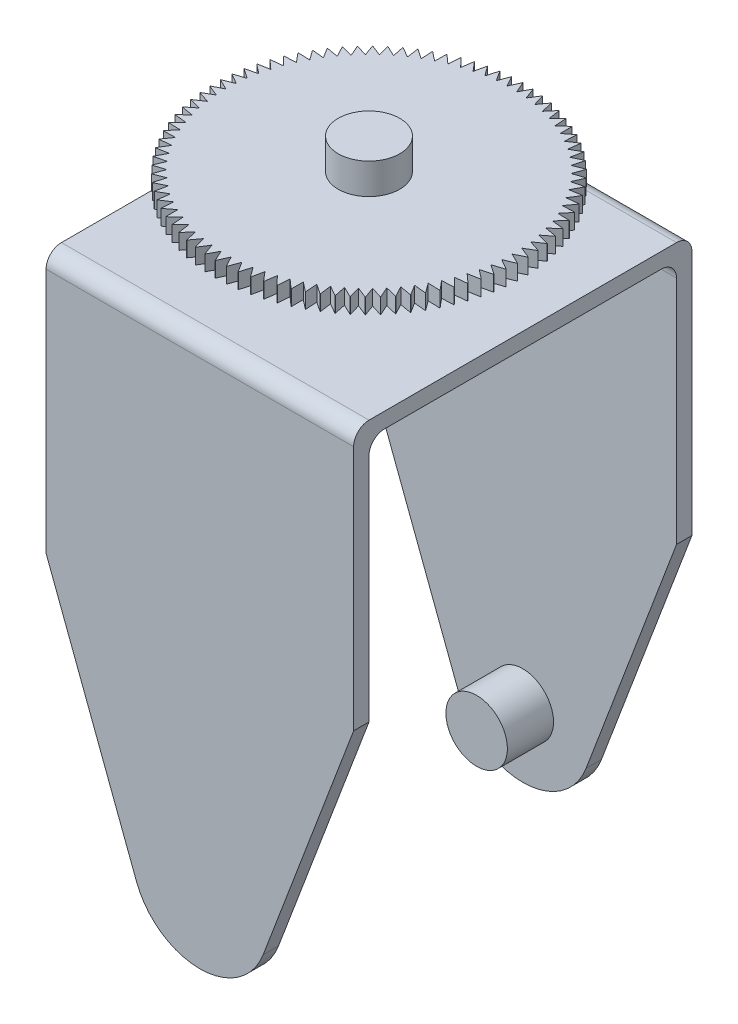
from build123d import *

# Parameters (mm, degrees)
BOSS_EXTRUDE1_DEPTH = 5
SKETCH4_R           = 10
BOSS_EXTRUDE2_DEPTH = 15
SKETCH5_W           = 100
SKETCH5_H           = 5
BOSS_EXTRUDE3_DEPTH = 55
FILLET1_R           = 5
SKETCH6_R           = 12.5
BOSS_EXTRUDE4_DEPTH = 5
SKETCH7_R           = 10
BOSS_EXTRUDE5_DEPTH = 5
SKETCH8_R           = 12.5
BOSS_EXTRUDE6_DEPTH = 5
BOSS_EXTRUDE7_DEPTH = 5
SKETCH10_R          = 10
BOSS_EXTRUDE8_DEPTH = 10


with BuildPart() as part:
    # Sketch3 → Boss-Extrude1 (new body)
    with BuildSketch(Plane.XY):
        with BuildLine():
            Line((-50, 150), (50, 150))
            Line((50, 150), (50, 70))
            Line((50, 70), (20.577059051, -7.783613608))
            ThreePointArc((20.577059051, -7.783613608), (0, -22), (-20.577059051, -7.783613608))
            Line((-20.577059051, -7.783613608), (-50, 70))
            Line((-50, 70), (-50, 150))
        make_face()
    extrude(amount=BOSS_EXTRUDE1_DEPTH)

    # Sketch4 → Boss-Extrude2 (add)
    with BuildSketch(Plane.XY.offset(5)):
        Circle(SKETCH4_R)
    extrude(amount=BOSS_EXTRUDE2_DEPTH)

    # Sketch5 → Boss-Extrude3 (add)
    with BuildSketch(Plane(origin=(0, 0, 0), x_dir=(-1, 0, 0), z_dir=(0, 0, -1))):
        with Locations((0, 152.5)):
            Rectangle(SKETCH5_W, SKETCH5_H)
    extrude(amount=-BOSS_EXTRUDE3_DEPTH)

    # Mirror1: part across plane


with BuildPart() as part_1:
    add(part.part)
    add(part.part.mirror(Plane.XY.offset(55)))

    # Fillet1
    fillet1_edges = [part_1.edges().sort_by_distance(p)[0] for p in [
        (0, 150, 105),
        (0, 150, 5),
        (0, 155, 110),
        (0, 155, 0),
    ]]
    fillet(fillet1_edges, radius=FILLET1_R)

    # Sketch6 → Boss-Extrude4 (add)
    with BuildSketch(Plane(origin=(0, 155, 0), x_dir=(1, 0, 0), z_dir=(0, 1, 0))):
        with Locations((0, -55)):
            Circle(SKETCH6_R)
    extrude(amount=BOSS_EXTRUDE4_DEPTH)

    # Sketch7 → Boss-Extrude5 (add)
    with BuildSketch(Plane(origin=(0, 160, 0), x_dir=(1, 0, 0), z_dir=(0, 1, 0))):
        with Locations((0, -55)):
            Circle(SKETCH7_R)
    extrude(amount=BOSS_EXTRUDE5_DEPTH)

    # Sketch8 → Boss-Extrude6 (add)
    with BuildSketch(Plane(origin=(0, 165, 0), x_dir=(1, 0, 0), z_dir=(0, 1, 0))):
        with Locations((0, -55)):
            Circle(SKETCH8_R)
    extrude(amount=BOSS_EXTRUDE6_DEPTH)

    # Sketch9 → Boss-Extrude7 (add)
    with BuildSketch(Plane(origin=(0, 170, 0), x_dir=(1, 0, 0), z_dir=(0, 1, 0))):
        with BuildLine():
            Line((1.592913605, -8.533590821), (0, -5))
            ThreePointArc((0, -5), (-0.03195169, -5.000010209), (-0.063903368, -5.000040836))
            Line((-0.063903368, -5.000040836), (-1.652299505, -8.535664623))
            Line((-1.652299505, -8.535664623), (-3.487823687, -5.121797487))
            ThreePointArc((-3.487823687, -5.121797487), (-3.519696833, -5.124036509), (-3.551568541, -5.126295898))
            Line((-3.551568541, -5.126295898), (-4.889462777, -8.764107995))
            Line((-4.889462777, -8.764107995), (-6.958655048, -5.486596563))
            ThreePointArc((-6.958655048, -5.486596563), (-6.990294366, -5.491053489), (-7.021930829, -5.495530632))
            Line((-7.021930829, -5.495530632), (-8.102805078, -9.217807986))
            Line((-8.102805078, -9.217807986), (-10.395584541, -6.092619963))
            ThreePointArc((-10.395584541, -6.092619963), (-10.426835888, -6.099273079), (-10.458082976, -6.105946165))
            Line((-10.458082976, -6.105946165), (-11.276671327, -9.894554215))
            Line((-11.276671327, -9.894554215), (-13.781867791, -6.936915203))
            ThreePointArc((-13.781867791, -6.936915203), (-13.812578913, -6.945732096), (-13.843284395, -6.954568613))
            Line((-13.843284395, -6.954568613), (-14.395598767, -10.791049641))
            Line((-14.395598767, -10.791049641), (-17.101007166, -8.015368961))
            ThreePointArc((-17.101007166, -8.015368961), (-17.131028442, -8.026306676), (-17.161042723, -8.037263573))
            Line((-17.161042723, -8.037263573), (-17.444392297, -11.90292663))
            Line((-17.444392297, -11.90292663), (-20.336832154, -9.322727118))
            ThreePointArc((-20.336832154, -9.322727118), (-20.366017323, -9.335732368), (-20.395194176, -9.348756265))
            Line((-20.395194176, -9.348756265), (-20.408198501, -13.224768228))
            Line((-20.408198501, -13.224768228), (-23.473578139, -10.852620357))
            ThreePointArc((-23.473578139, -10.852620357), (-23.501785015, -10.867629781), (-23.529982293, -10.882657227))
            Line((-23.529982293, -10.882657227), (-23.272578014, -14.750134555))
            Line((-23.272578014, -14.750134555), (-26.495963212, -12.597595192))
            ThreePointArc((-26.495963212, -12.597595192), (-26.523054372, -12.614535666), (-26.550134701, -12.631493449))
            Line((-26.550134701, -12.631493449), (-26.023575865, -16.471594182))
            Line((-26.023575865, -16.471594182), (-29.389262615, -14.549150281))
            ThreePointArc((-29.389262615, -14.549150281), (-29.415106074, -14.567939273), (-29.440937522, -14.586744776))
            Line((-29.440937522, -14.586744776), (-28.647789471, -18.380760329))
            Line((-28.647789471, -18.380760329), (-32.139380484, -16.697777844))
            ThreePointArc((-32.139380484, -16.697777844), (-32.163850337, -16.718323815), (-32.188307055, -16.73888542))
            Line((-32.188307055, -16.73888542), (-31.132433927, -20.46833173))
            Line((-31.132433927, -20.46833173), (-34.732918523, -19.033009983))
            ThreePointArc((-34.732918523, -19.033009983), (-34.755895554, -19.055212836), (-34.778858391, -19.077430368))
            Line((-34.778858391, -19.077430368), (-33.465404293, -22.724137948))
            Line((-33.465404293, -22.724137948), (-37.157241274, -21.543469682))
            ThreePointArc((-37.157241274, -21.543469682), (-37.178613541, -21.567221247), (-37.199970626, -21.590986464))
            Line((-37.199970626, -21.590986464), (-35.635334574, -25.137188922))
            Line((-35.635334574, -25.137188922), (-39.40053768, -24.216926234))
            ThreePointArc((-39.40053768, -24.216926234), (-39.42020106, -24.242110795), (-39.439848343, -24.267307916))
            Line((-39.439848343, -24.267307916), (-37.631653087, -27.695728509))
            Line((-37.631653087, -27.695728509), (-41.451878628, -27.040354827))
            ThreePointArc((-41.451878628, -27.040354826), (-41.469737323, -27.066849687), (-41.487579083, -27.093355955))
            Line((-41.487579083, -27.093355955), (-39.444633969, -30.387291763))
            Line((-39.444633969, -30.387291763), (-43.301270189, -30))
            ThreePointArc((-43.301270189, -30), (-43.317237193, -30.02767608), (-43.333186508, -30.055362358))
            Line((-43.333186508, -30.055362358), (-41.065444559, -33.198765657))
            Line((-41.065444559, -33.198765657), (-44.939702315, -33.081442661))
            ThreePointArc((-44.939702315, -33.081442661), (-44.953699838, -33.110165125), (-44.967679004, -33.138896529))
            Line((-44.967679004, -33.138896529), (-42.486188431, -36.116452973))
            Line((-42.486188431, -36.116452973), (-46.359192728, -36.269670329))
            ThreePointArc((-46.359192728, -36.269670329), (-46.371152577, -36.299299245), (-46.383093488, -36.328935798))
            Line((-46.383093488, -36.328935798), (-43.699943864, -39.126139033))
            Line((-43.699943864, -39.126139033), (-47.552825815, -39.549150281))
            ThreePointArc((-47.552825815, -39.549150281), (-47.562689721, -39.579541299), (-47.572534204, -39.609938615))
            Line((-47.572534204, -39.609938615), (-44.700797563, -42.213160947))
            Line((-44.700797563, -42.213160947), (-48.514786314, -42.90390522))
            ThreePointArc((-48.514786314, -42.90390522), (-48.522506221, -42.934910279), (-48.530206314, -42.965920264))
            Line((-48.530206314, -42.965920264), (-45.483873469, -45.362479056))
            Line((-45.483873469, -45.362479056), (-49.240387651, -46.317591117))
            ThreePointArc((-49.240387651, -46.317591117), (-49.245925949, -46.349059162), (-49.251444138, -46.38053074))
            Line((-49.251444138, -46.38053074), (-46.045356516, -48.558750198))
            Line((-46.045356516, -48.558750198), (-49.726094768, -49.773576837))
            ThreePointArc((-49.726094768, -49.773576837), (-49.729424476, -49.80535456), (-49.732733877, -49.837134404))
            Line((-49.732733876, -49.837134404), (-46.382511214, -51.786402461))
            Line((-46.382511214, -51.786402461), (-49.969541351, -53.255025165))
            ThreePointArc((-49.969541351, -53.255025165), (-49.970646246, -53.286957748), (-49.971730735, -53.31889103))
            Line((-49.971730735, -53.31889103), (-46.493694981, -55.029711049))
            Line((-46.493694981, -55.029711049), (-49.969541351, -56.744974835))
            ThreePointArc((-49.969541351, -56.744974835), (-49.96841605, -56.776906705), (-49.967270344, -56.80883785))
            Line((-49.967270344, -56.80883785), (-46.378366138, -58.272874888))
            Line((-46.378366138, -58.272874888), (-49.726094768, -60.226423163))
            ThreePointArc((-49.726094768, -60.226423163), (-49.722744754, -60.258198752), (-49.719374435, -60.289972193))
            Line((-49.719374435, -60.289972193), (-46.037086558, -61.500093609))
            Line((-46.037086558, -61.500093609), (-49.240387651, -63.682408883))
            ThreePointArc((-49.240387651, -63.682408883), (-49.234829244, -63.713873383), (-49.229250731, -63.745334324))
            Line((-49.229250731, -63.745334324), (-45.47151892, -64.695644527))
            Line((-45.47151892, -64.695644527), (-48.514786314, -67.09609478))
            ThreePointArc((-48.514786314, -67.09609478), (-48.507046594, -67.127094899), (-48.499287066, -67.158090066))
            Line((-48.499287066, -67.158090066), (-44.684418613, -67.84395924))
            Line((-44.684418613, -67.84395924), (-47.552825815, -70.450849719))
            ThreePointArc((-47.552825815, -70.450849719), (-47.54294249, -70.481234427), (-47.53303975, -70.511612814))
            Line((-47.53303975, -70.511612814), (-43.679620309, -70.929699475))
            Line((-43.679620309, -70.929699475), (-46.359192728, -73.730329671))
            ThreePointArc((-46.359192728, -73.730329671), (-46.347213949, -73.759950938), (-46.335216242, -73.789564544))
            Line((-46.335216242, -73.789564544), (-42.462019286, -73.937831815))
            Line((-42.462019286, -73.937831815), (-44.939702315, -76.91855734))
            ThreePointArc((-44.939702315, -76.91855734), (-44.92568644, -76.947270853), (-44.911652219, -76.975975405))
            Line((-44.911652219, -76.975975405), (-41.037547574, -76.853700942))
            Line((-41.037547574, -76.853700942), (-43.301270189, -80))
            ThreePointArc((-43.301270189, -80), (-43.285285503, -80.027665871), (-43.26928314, -80.055321522))
            Line((-43.26928314, -80.055321522), (-39.413145054, -79.663101034))
            Line((-39.413145054, -79.663101034), (-41.451878628, -82.959645174))
            ThreePointArc((-41.451878628, -82.959645174), (-41.434003005, -82.986128617), (-41.416110463, -83.012600631))
            Line((-41.416110463, -83.012600631), (-37.596725654, -82.352344978))
            Line((-37.596725654, -82.352344978), (-39.40053768, -85.783073766))
            ThreePointArc((-39.40053768, -85.783073766), (-39.380858211, -85.808245757), (-39.361162659, -85.833405166))
            Line((-39.361162659, -85.833405166), (-35.597138786, -84.908331046))
            Line((-35.597138786, -84.908331046), (-37.157241274, -88.456530318))
            ThreePointArc((-37.157241274, -88.456530318), (-37.135853833, -88.48026822), (-37.114451227, -88.50399245))
            Line((-37.114451227, -88.50399245), (-33.424126235, -87.318606732))
            Line((-33.424126235, -87.318606732), (-34.732918523, -90.966990017))
            ThreePointArc((-34.732918523, -90.966990017), (-34.709927308, -90.989178182), (-34.68692192, -91.011351651))
            Line((-34.68692192, -91.011351651), (-31.088274702, -89.571429415))
            Line((-31.088274702, -89.571429415), (-32.139380484, -93.302222156))
            ThreePointArc((-32.139380484, -93.302222156), (-32.114897507, -93.322752486), (-32.090401415, -93.343267167))
            Line((-32.090401415, -93.343267167), (-28.600964219, -91.655823568))
            Line((-28.600964219, -91.655823568), (-29.389262615, -95.450849719))
            ThreePointArc((-29.389262615, -95.450849719), (-29.363407153, -95.469622192), (-29.337539701, -95.488378139))
            Line((-29.337539701, -95.488378139), (-25.974312713, -93.561634234))
            Line((-25.974312713, -93.561634234), (-26.495963212, -97.402404808))
            ThreePointArc((-26.495963212, -97.402404808), (-26.468861231, -97.419327966), (-26.441748442, -97.436233802))
            Line((-26.441748442, -97.436233802), (-23.221116967, -95.279576494))
            Line((-23.221116967, -95.279576494), (-23.473578139, -99.147379643))
            ThreePointArc((-23.473578139, -99.147379643), (-23.445361678, -99.162371039), (-23.417135643, -99.177344401))
            Line((-23.417135643, -99.177344401), (-20.354790273, -96.801280706))
            Line((-20.354790273, -96.801280706), (-20.336832154, -100.677272882))
            ThreePointArc((-20.336832154, -100.677272882), (-20.30763868, -100.690259479), (-20.278436913, -100.703227418))
            Line((-20.278436913, -100.703227418), (-17.389297087, -98.11933328))
            Line((-17.389297087, -98.11933328), (-17.101007166, -101.984631039))
            ThreePointArc((-17.101007166, -101.984631039), (-17.070978907, -101.995549568), (-17.040943676, -102.006448905))
            Line((-17.040943676, -102.006448905), (-14.339084993, -99.227312797))
            Line((-14.339084993, -99.227312797), (-13.781867791, -103.063084797))
            ThreePointArc((-13.781867791, -103.063084797), (-13.751151041, -103.071882063), (-13.720428675, -103.080659698))
            Line((-13.720428675, -103.080659698), (-11.219014319, -100.119821292))
            Line((-11.219014319, -100.119821292), (-10.395584541, -103.907380037))
            ThreePointArc((-10.395584541, -103.907380037), (-10.364328949, -103.914013181), (-10.333069124, -103.92062635))
            Line((-10.333069124, -103.92062635), (-8.044285735, -100.792510553))
            Line((-8.044285735, -100.792510553), (-6.958655048, -104.513403437))
            ThreePointArc((-6.958655048, -104.513403437), (-6.927012888, -104.517840143), (-6.8953679, -104.522256628))
            Line((-6.8953679, -104.522256628), (-4.830366199, -101.242103305))
            Line((-4.830366199, -101.242103305), (-3.487823687, -104.878202513))
            ThreePointArc((-3.487823687, -104.878202513), (-3.455949117, -104.880421166), (-3.424073136, -104.88261945))
            Line((-3.424073136, -104.88261945), (-1.592913605, -101.466409179))
            Line((-1.592913605, -101.466409179), (0, -105))
            ThreePointArc((0, -105), (0.031951691, -104.999989791), (0.063903368, -104.999959164))
            Line((0.063903368, -104.999959164), (1.652299505, -101.464335377))
            Line((1.652299505, -101.464335377), (3.487823687, -104.878202513))
            ThreePointArc((3.487823687, -104.878202513), (3.519696833, -104.875963491), (3.551568541, -104.873704102))
            Line((3.551568541, -104.873704102), (4.889462777, -101.235892005))
            Line((4.889462777, -101.235892005), (6.958655048, -104.513403437))
            ThreePointArc((6.958655048, -104.513403437), (6.990294366, -104.508946511), (7.021930829, -104.504469368))
            Line((7.021930829, -104.504469368), (8.102805078, -100.782192014))
            Line((8.102805078, -100.782192014), (10.395584541, -103.907380037))
            ThreePointArc((10.395584541, -103.907380037), (10.426835888, -103.900726921), (10.458082977, -103.894053835))
            Line((10.458082977, -103.894053835), (11.276671327, -100.105445785))
            Line((11.276671327, -100.105445785), (13.781867791, -103.063084797))
            ThreePointArc((13.781867791, -103.063084797), (13.812578913, -103.054267904), (13.843284395, -103.045431387))
            Line((13.843284395, -103.045431387), (14.395598767, -99.208950359))
            Line((14.395598767, -99.208950359), (17.101007166, -101.984631039))
            ThreePointArc((17.101007166, -101.984631039), (17.131028442, -101.973693324), (17.161042723, -101.962736427))
            Line((17.161042723, -101.962736427), (17.444392297, -98.09707337))
            Line((17.444392297, -98.09707337), (20.336832154, -100.677272882))
            ThreePointArc((20.336832154, -100.677272882), (20.366017323, -100.664267632), (20.395194176, -100.651243735))
            Line((20.395194176, -100.651243735), (20.408198501, -96.775231772))
            Line((20.408198501, -96.775231772), (23.473578139, -99.147379643))
            ThreePointArc((23.473578139, -99.147379643), (23.501785015, -99.132370219), (23.529982293, -99.117342772))
            Line((23.529982293, -99.117342773), (23.272578014, -95.249865445))
            Line((23.272578014, -95.249865445), (26.495963212, -97.402404808))
            ThreePointArc((26.495963212, -97.402404808), (26.523054372, -97.385464334), (26.550134701, -97.368506551))
            Line((26.550134701, -97.368506551), (26.023575865, -93.528405818))
            Line((26.023575865, -93.528405818), (29.389262615, -95.450849719))
            ThreePointArc((29.389262615, -95.450849719), (29.415106075, -95.432060727), (29.440937522, -95.413255224))
            Line((29.440937522, -95.413255224), (28.647789471, -91.619239671))
            Line((28.647789471, -91.619239671), (32.139380484, -93.302222156))
            ThreePointArc((32.139380484, -93.302222156), (32.163850337, -93.281676185), (32.188307055, -93.26111458))
            Line((32.188307055, -93.26111458), (31.132433927, -89.53166827))
            Line((31.132433927, -89.53166827), (34.732918523, -90.966990017))
            ThreePointArc((34.732918523, -90.966990017), (34.755895554, -90.944787164), (34.778858392, -90.922569632))
            Line((34.778858392, -90.922569632), (33.465404293, -87.275862052))
            Line((33.465404293, -87.275862052), (37.157241274, -88.456530318))
            ThreePointArc((37.157241274, -88.456530318), (37.178613541, -88.432778753), (37.199970626, -88.409013536))
            Line((37.199970626, -88.409013536), (35.635334574, -84.862811078))
            Line((35.635334574, -84.862811078), (39.40053768, -85.783073766))
            ThreePointArc((39.40053768, -85.783073766), (39.42020106, -85.757889205), (39.439848343, -85.732692084))
            Line((39.439848343, -85.732692084), (37.631653087, -82.304271491))
            Line((37.631653087, -82.304271491), (41.451878628, -82.959645173))
            ThreePointArc((41.451878628, -82.959645173), (41.469737323, -82.933150313), (41.487579083, -82.906644045))
            Line((41.487579083, -82.906644045), (39.444633969, -79.612708237))
            Line((39.444633969, -79.612708237), (43.301270189, -80))
            ThreePointArc((43.301270189, -80), (43.317237193, -79.97232392), (43.333186508, -79.944637642))
            Line((43.333186508, -79.944637642), (41.065444559, -76.801234343))
            Line((41.065444559, -76.801234343), (44.939702315, -76.918557339))
            ThreePointArc((44.939702315, -76.918557339), (44.953699838, -76.889834875), (44.967679004, -76.861103471))
            Line((44.967679004, -76.861103471), (42.486188431, -73.883547027))
            Line((42.486188431, -73.883547027), (46.359192728, -73.730329671))
            ThreePointArc((46.359192728, -73.730329671), (46.371152577, -73.700700755), (46.383093488, -73.671064202))
            Line((46.383093488, -73.671064202), (43.699943864, -70.873860967))
            Line((43.699943864, -70.873860967), (47.552825815, -70.450849719))
            ThreePointArc((47.552825815, -70.450849719), (47.562689721, -70.4204587), (47.572534204, -70.390061385))
            Line((47.572534204, -70.390061385), (44.700797563, -67.786839053))
            Line((44.700797563, -67.786839053), (48.514786314, -67.09609478))
            ThreePointArc((48.514786314, -67.09609478), (48.522506221, -67.065089721), (48.530206314, -67.034079736))
            Line((48.530206314, -67.034079736), (45.483873469, -64.637520944))
            Line((45.483873469, -64.637520944), (49.240387651, -63.682408883))
            ThreePointArc((49.240387651, -63.682408883), (49.245925949, -63.650940838), (49.251444138, -63.61946926))
            Line((49.251444138, -63.61946926), (46.045356516, -61.441249802))
            Line((46.045356516, -61.441249802), (49.726094768, -60.226423163))
            ThreePointArc((49.726094768, -60.226423163), (49.729424476, -60.19464544), (49.732733877, -60.162865596))
            Line((49.732733877, -60.162865596), (46.382511215, -58.213597539))
            Line((46.382511215, -58.213597539), (49.969541351, -56.744974835))
            ThreePointArc((49.969541351, -56.744974835), (49.970646246, -56.713042252), (49.971730735, -56.68110897))
            Line((49.971730735, -56.68110897), (46.493694981, -54.970288951))
            Line((46.493694981, -54.970288951), (49.969541351, -53.255025165))
            ThreePointArc((49.969541351, -53.255025165), (49.96841605, -53.223093295), (49.967270344, -53.19116215))
            Line((49.967270344, -53.19116215), (46.378366139, -51.727125112))
            Line((46.378366139, -51.727125112), (49.726094768, -49.773576837))
            ThreePointArc((49.726094768, -49.773576837), (49.722744754, -49.741801248), (49.719374435, -49.710027807))
            Line((49.719374435, -49.710027807), (46.037086558, -48.499906391))
            Line((46.037086558, -48.499906391), (49.240387651, -46.317591117))
            ThreePointArc((49.240387651, -46.317591117), (49.234829244, -46.286126617), (49.229250731, -46.254665676))
            Line((49.229250731, -46.254665676), (45.47151892, -45.304355473))
            Line((45.47151892, -45.304355473), (48.514786314, -42.90390522))
            ThreePointArc((48.514786314, -42.90390522), (48.507046594, -42.872905101), (48.499287066, -42.841909934))
            Line((48.499287067, -42.841909934), (44.684418613, -42.15604076))
            Line((44.684418613, -42.15604076), (47.552825815, -39.549150281))
            ThreePointArc((47.552825815, -39.549150281), (47.54294249, -39.518765573), (47.53303975, -39.488387186))
            Line((47.53303975, -39.488387186), (43.679620309, -39.070300525))
            Line((43.679620309, -39.070300525), (46.359192728, -36.269670329))
            ThreePointArc((46.359192728, -36.269670329), (46.347213949, -36.240049062), (46.335216243, -36.210435456))
            Line((46.335216243, -36.210435456), (42.462019286, -36.062168185))
            Line((42.462019286, -36.062168185), (44.939702315, -33.08144266))
            ThreePointArc((44.939702315, -33.081442661), (44.92568644, -33.052729147), (44.911652219, -33.024024595))
            Line((44.911652219, -33.024024595), (41.037547574, -33.146299058))
            Line((41.037547574, -33.146299058), (43.301270189, -30))
            ThreePointArc((43.301270189, -30), (43.285285503, -29.972334129), (43.26928314, -29.944678478))
            Line((43.26928314, -29.944678478), (39.413145054, -30.336898966))
            Line((39.413145054, -30.336898966), (41.451878628, -27.040354826))
            ThreePointArc((41.451878628, -27.040354826), (41.434003005, -27.013871383), (41.416110463, -26.987399369))
            Line((41.416110463, -26.987399369), (37.596725654, -27.647655022))
            Line((37.596725654, -27.647655022), (39.40053768, -24.216926234))
            ThreePointArc((39.40053768, -24.216926234), (39.380858211, -24.191754243), (39.361162659, -24.166594834))
            Line((39.361162659, -24.166594834), (35.597138786, -25.091668954))
            Line((35.597138786, -25.091668954), (37.157241274, -21.543469682))
            ThreePointArc((37.157241274, -21.543469682), (37.135853833, -21.51973178), (37.114451227, -21.49600755))
            Line((37.114451227, -21.49600755), (33.424126236, -22.681393268))
            Line((33.424126236, -22.681393268), (34.732918523, -19.033009983))
            ThreePointArc((34.732918523, -19.033009983), (34.709927308, -19.010821818), (34.68692192, -18.988648349))
            Line((34.68692192, -18.988648349), (31.088274702, -20.428570585))
            Line((31.088274702, -20.428570585), (32.139380484, -16.697777844))
            ThreePointArc((32.139380484, -16.697777844), (32.114897507, -16.677247514), (32.090401415, -16.656732833))
            Line((32.090401415, -16.656732833), (28.600964219, -18.344176432))
            Line((28.600964219, -18.344176432), (29.389262615, -14.549150281))
            ThreePointArc((29.389262615, -14.549150281), (29.363407153, -14.530377808), (29.337539701, -14.511621861))
            Line((29.337539701, -14.511621861), (25.974312713, -16.438365766))
            Line((25.974312713, -16.438365766), (26.495963212, -12.597595192))
            ThreePointArc((26.495963212, -12.597595192), (26.468861231, -12.580672034), (26.441748442, -12.563766198))
            Line((26.441748442, -12.563766198), (23.221116967, -14.720423506))
            Line((23.221116967, -14.720423506), (23.473578139, -10.852620357))
            ThreePointArc((23.473578139, -10.852620357), (23.445361678, -10.837628961), (23.417135643, -10.822655599))
            Line((23.417135643, -10.822655599), (20.354790273, -13.198719294))
            Line((20.354790273, -13.198719294), (20.336832154, -9.322727118))
            ThreePointArc((20.336832154, -9.322727118), (20.30763868, -9.309740521), (20.278436913, -9.296772582))
            Line((20.278436913, -9.296772582), (17.389297087, -11.88066672))
            Line((17.389297087, -11.88066672), (17.101007166, -8.015368961))
            ThreePointArc((17.101007166, -8.015368961), (17.070978907, -8.004450432), (17.040943676, -7.993551095))
            Line((17.040943676, -7.993551095), (14.339084994, -10.772687203))
            Line((14.339084994, -10.772687203), (13.781867791, -6.936915203))
            ThreePointArc((13.781867791, -6.936915203), (13.751151041, -6.928117937), (13.720428675, -6.919340302))
            Line((13.720428675, -6.919340302), (11.219014319, -9.880178708))
            Line((11.219014319, -9.880178708), (10.395584541, -6.092619963))
            ThreePointArc((10.395584541, -6.092619963), (10.364328949, -6.085986819), (10.333069125, -6.07937365))
            Line((10.333069125, -6.07937365), (8.044285735, -9.207489447))
            Line((8.044285735, -9.207489447), (6.958655048, -5.486596563))
            ThreePointArc((6.958655048, -5.486596563), (6.927012888, -5.482159857), (6.8953679, -5.477743372))
            Line((6.8953679, -5.477743372), (4.830366199, -8.757896695))
            Line((4.830366199, -8.757896695), (3.487823687, -5.121797487))
            ThreePointArc((3.487823687, -5.121797487), (3.455949117, -5.119578834), (3.424073136, -5.11738055))
            Line((3.424073136, -5.11738055), (1.592913605, -8.533590821))
        make_face()
    extrude(amount=BOSS_EXTRUDE7_DEPTH)

    # Sketch10 → Boss-Extrude8 (add)
    with BuildSketch(Plane(origin=(0, 175, 0), x_dir=(1, 0, 0), z_dir=(0, 1, 0))):
        with Locations((0, -55)):
            Circle(SKETCH10_R)
    extrude(amount=BOSS_EXTRUDE8_DEPTH)


solid = part_1.part
